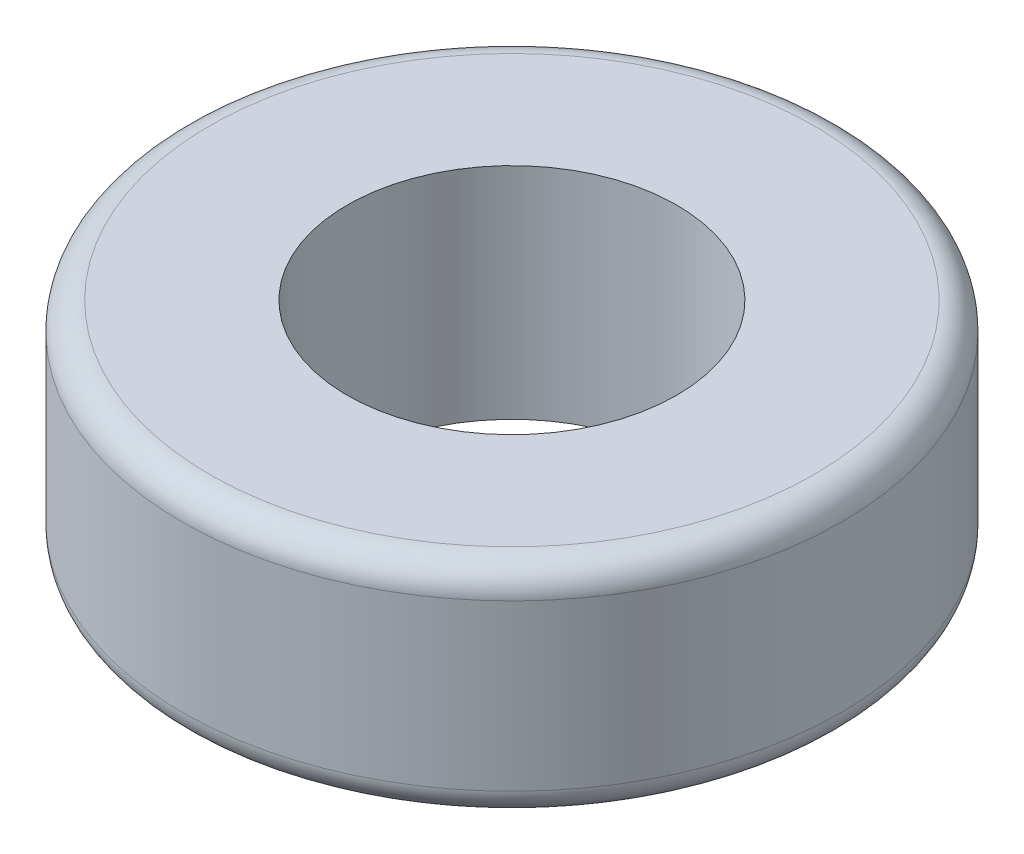
from build123d import *

# Parameters (mm, degrees)
SKETCH_1_W = 4.5
SKETCH_1_H = 7


with BuildPart() as part:
    # 草图1 → 旋转3 (revolve)
    with BuildSketch(Plane.XY):
        with BuildLine():
            Line((7.5, 5), (7.5, -5))
            Line((7.5, -5), (13.75, -5))
            ThreePointArc((13.75, -5), (14.633883476, -4.633883476), (15, -3.75))
            Line((15, -3.75), (15, 3.75))
            ThreePointArc((15, 3.75), (14.633883476, 4.633883476), (13.75, 5))
            Line((13.75, 5), (7.5, 5))
        make_face()
        with Locations((11.25, 0)):
            Rectangle(SKETCH_1_W, SKETCH_1_H, mode=Mode.SUBTRACT)
    revolve(axis=Axis((0, -346.416551839, 0), (0, 1, 0)))


solid = part.part
